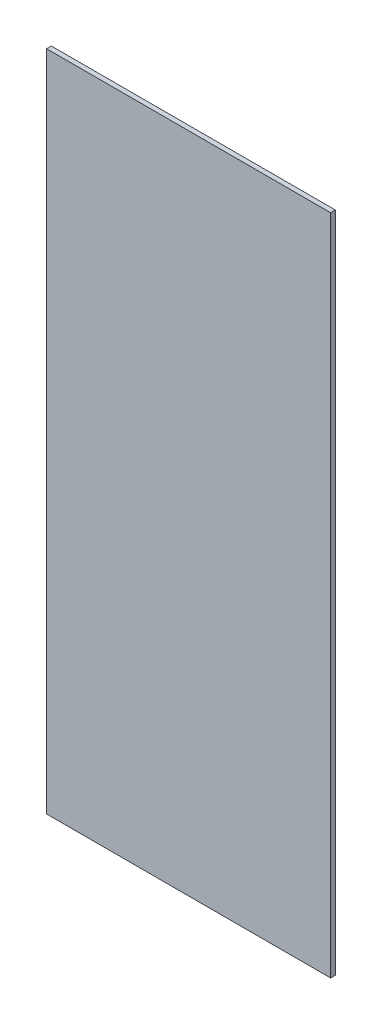
from build123d import *

# Parameters (mm, degrees)
SKETCH1_W           = 300
SKETCH1_H           = 700
BOSS_EXTRUDE1_DEPTH = 5


with BuildPart() as part:
    # Sketch1 → Boss-Extrude1 (new body)
    with BuildSketch(Plane.XY):
        with Locations((150, 350)):
            Rectangle(SKETCH1_W, SKETCH1_H)
    extrude(amount=BOSS_EXTRUDE1_DEPTH)


solid = part.part
